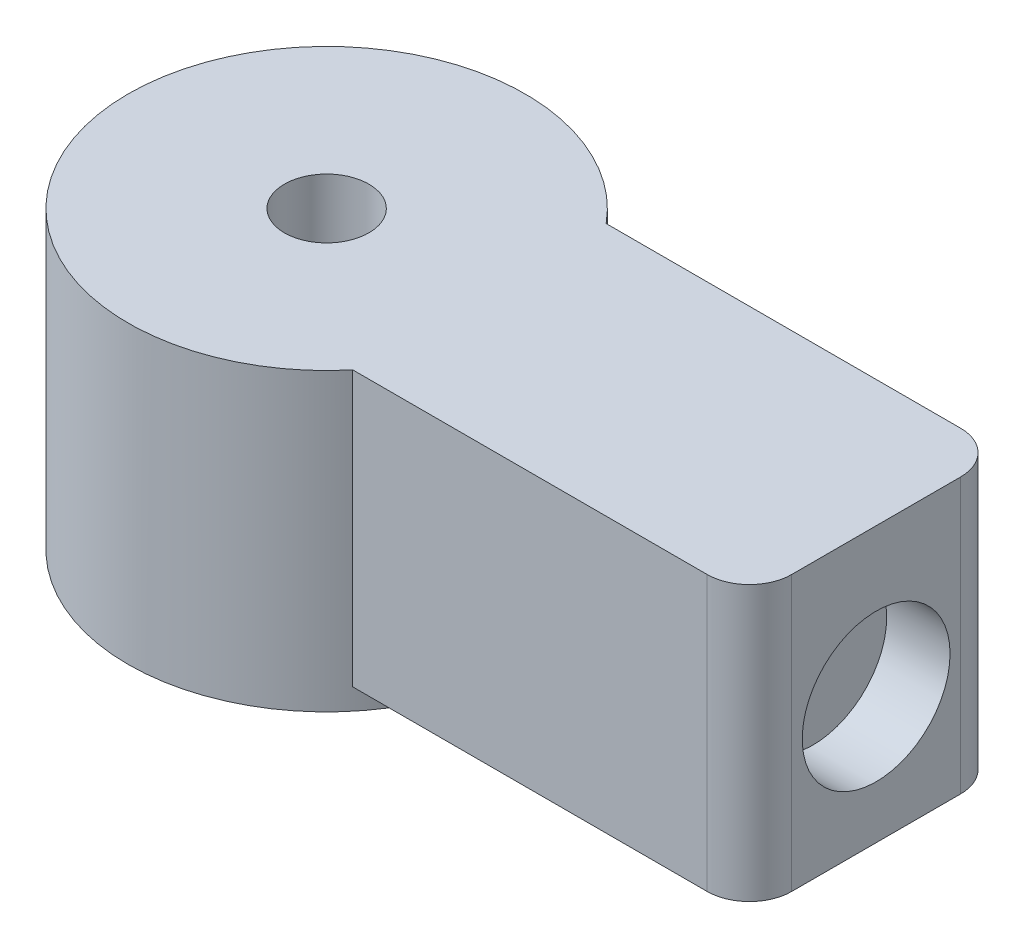
from build123d import *

# Parameters (mm, degrees)
SKETCH1_R           = 4.7
SKETCH1_R_2         = 2.5
BOSS_EXTRUDE1_DEPTH = 2.5
SKETCH2_R           = 4.7
BOSS_EXTRUDE2_DEPTH = 4.5
SKETCH3_R           = 1
CUT_EXTRUDE1_DEPTH  = 4.5
SKETCH6_W           = 6
SKETCH6_H           = 6
BOSS_EXTRUDE3_DEPTH = 8.31
SKETCH7_W           = 6
SKETCH7_H           = 6
BOSS_EXTRUDE4_DEPTH = 2
FILLET1_R           = 1
SKETCH8_R           = 1.75
CUT_EXTRUDE2_DEPTH  = 1.5
BOSS_EXTRUDE5_DEPTH = 0.5


with BuildPart() as part:
    # Sketch1 → Boss-Extrude1 (new body)
    with BuildSketch(Plane(origin=(0, 0, 0), x_dir=(1, 0, 0), z_dir=(0, 1, 0))):
        with Locations(Location((0, 0, 0), (0, 0, 270))):
            Circle(SKETCH1_R)
        with Locations(Location((0, 0, 0), (0, 0, 270))):
            Circle(SKETCH1_R_2, mode=Mode.SUBTRACT)
    extrude(amount=BOSS_EXTRUDE1_DEPTH)

    # Sketch2 → Boss-Extrude2 (add)
    with BuildSketch(Plane(origin=(0, 2.5, 0), x_dir=(1, 0, 0), z_dir=(0, 1, 0))):
        with Locations(Location((0, 0, 0), (0, 0, 270))):
            Circle(SKETCH2_R)
    extrude(amount=BOSS_EXTRUDE2_DEPTH)

    # Sketch3 → Cut-Extrude1 (cut)
    with BuildSketch(Plane(origin=(0, 7, 0), x_dir=(1, 0, 0), z_dir=(0, 1, 0))):
        with Locations(Location((0, 0, 0), (0, 0, 270))):
            Circle(SKETCH3_R)
    extrude(amount=-CUT_EXTRUDE1_DEPTH, mode=Mode.SUBTRACT)



with BuildPart() as body_2:
    # Sketch6 → Boss-Extrude3 (new body)
    with BuildSketch(Plane(origin=(4.7, 0, 0), x_dir=(0, 0, -1), z_dir=(1, 0, 0))):
        with Locations((0, 3.5)):
            Rectangle(SKETCH6_W, SKETCH6_H)
    extrude(amount=BOSS_EXTRUDE3_DEPTH)


with BuildPart() as part_1:
    add(part.part)

    add(body_2.part)  # Boss-Extrude4 merges body 2
    # Sketch7 → Boss-Extrude4 (add)
    with BuildSketch(Plane.ZY.offset(-4.7)):
        with Locations((0, 3.5)):
            Rectangle(SKETCH7_W, SKETCH7_H)
    extrude(amount=BOSS_EXTRUDE4_DEPTH)

    # Fillet1
    fillet1_edges = [part_1.edges().sort_by_distance(p)[0] for p in [
        (13.01, 3.5, -3),
        (13.01, 3.5, 3),
    ]]
    fillet(fillet1_edges, radius=FILLET1_R)

    # Sketch8 → Cut-Extrude2 (cut)
    with BuildSketch(Plane(origin=(13.01, 0, 0), x_dir=(0, 0, -1), z_dir=(1, 0, 0))):
        with Locations((0, 3.5)):
            Circle(SKETCH8_R)
    extrude(amount=-CUT_EXTRUDE2_DEPTH, mode=Mode.SUBTRACT)

    # Sketch9 → Boss-Extrude5 (add)
    with BuildSketch(Plane(origin=(0, 6.5, 0), x_dir=(1, 0, 0), z_dir=(0, 1, 0))):
        with BuildLine():
            Line((13.01, -2), (13.01, 2))
            ThreePointArc((13.01, 2), (12.717106781, 2.707106781), (12.01, 3))
            Line((12.01, 3), (3.618010503, 3))
            ThreePointArc((3.618010503, 3), (4.7, 0), (3.618010503, -3))
            Line((3.618010503, -3), (12.01, -3))
            ThreePointArc((12.01, -3), (12.717106781, -2.707106781), (13.01, -2))
        make_face()
    extrude(amount=BOSS_EXTRUDE5_DEPTH)


solid = part_1.part
